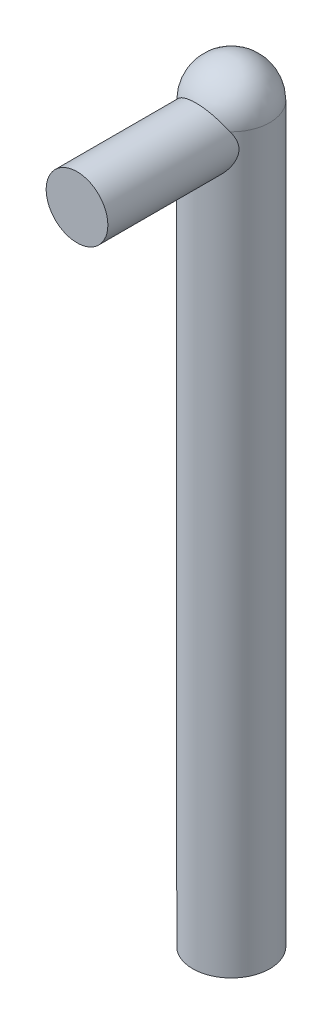
from build123d import *

# Parameters (mm, degrees)
SKETCH_1_R      = 25
EXTRUDE_1_DEPTH = 500
FILLET_1_R      = 25
SKETCH_3_R      = 20
EXTRUDE_2_DEPTH = 100


with BuildPart() as part:
    # 草图1 → 凸台-拉伸1 (new body)
    with BuildSketch(Plane(origin=(0, 0, 0), x_dir=(1, 0, 0), z_dir=(0, 1, 0))):
        with Locations(Location((0, 0, 0), (0, 0, 270))):
            Circle(SKETCH_1_R)
    extrude(amount=EXTRUDE_1_DEPTH)

    # 圆角1
    fillet_1_edges = [part.edges().sort_by_distance(p)[0] for p in [
        (0, 500, -25),
    ]]
    fillet(fillet_1_edges, radius=FILLET_1_R)

    # 草图3 → 凸台-拉伸2 (add)
    with BuildSketch(Plane.XY):
        with Locations(Location((0, 465, 0), (0, 0, 149.999999999))):
            Circle(SKETCH_3_R)
    extrude(amount=EXTRUDE_2_DEPTH)


solid = part.part
